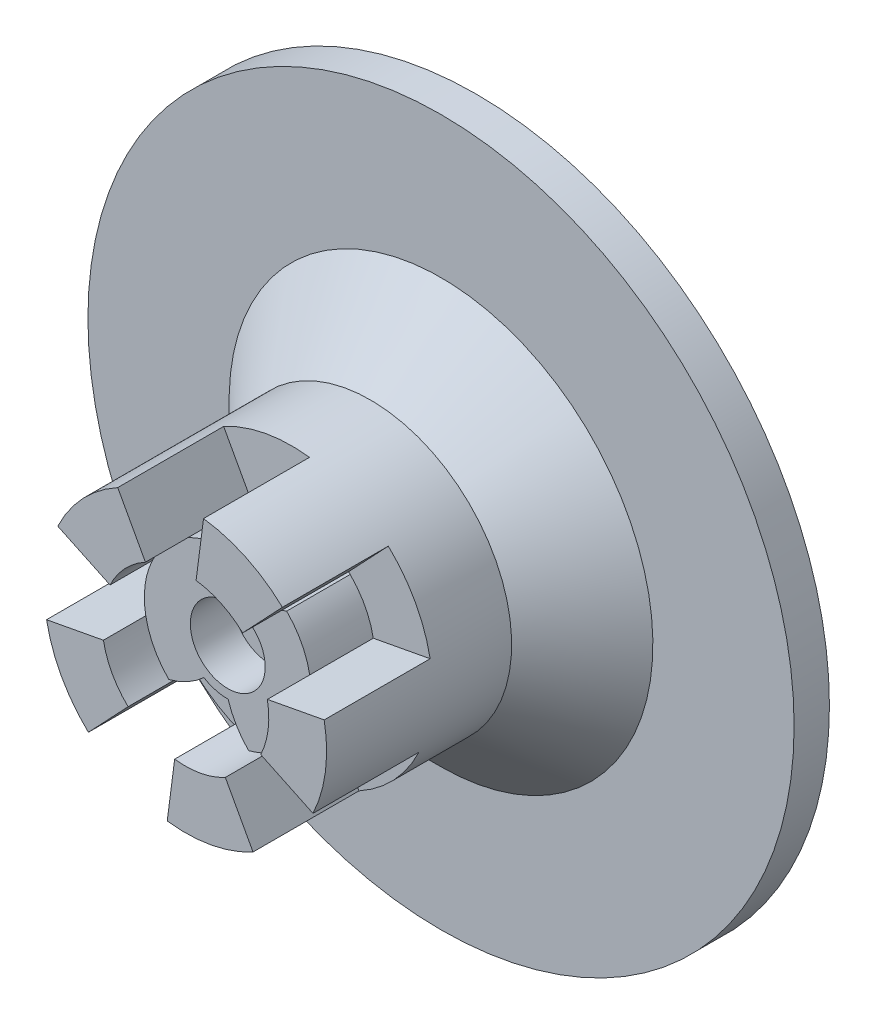
from build123d import *

# Parameters (mm, degrees)
SKETCH11_R          = 3.3672
CUT_EXTRUDE5_DEPTH  = 3.81
SKETCH11_5_R        = 3.3672
CUT_EXTRUDE7_DEPTH  = 7.62
CUT_EXTRUDE8_DEPTH  = 10.16
SKETCH13_R          = 6.35
CUT_EXTRUDE10_DEPTH = 12.192
CHAMFER1_SIZE       = 5.842
CHAMFER2_SIZE       = 6.35
CUT_EXTRUDE11_DEPTH = 9.525


with BuildPart() as part:
    # Sketch2 → Revolve1 (revolve)
    with BuildSketch(Plane(origin=(0, 0, 0), x_dir=(0, 0, -1), z_dir=(1, 0, 0))):
        Polygon((-13.081, 0), (-13.081, 9.525), (-13.081, 12.7), (-9.906, 12.7), (9.906, 12.7), (9.906, 31.75), (13.081, 31.75), (13.081, 0), align=None)
    revolve(axis=Axis((0, 0, -13.081), (0, 0, 1)))

    # Sketch11 → Cut-Extrude5 (cut)
    # profile 1 of 4: a face of its own
    with BuildSketch(Plane.XY.offset(13.081)):
        with BuildLine():
            ThreePointArc((-5.295442149, -5.31114794), (-1.969377828, -7.23681912), (1.873833325, -7.262144908))
            ThreePointArc((1.873833325, -7.262144908), (0.767613275, -5.832118974), (0.033615166, -4.179864833))
            ThreePointArc((0.033615166, -4.179864833), (-1.097599909, -4.033320523), (-2.147079662, -3.586425647))
            ThreePointArc((-2.147079662, -3.586425647), (-3.617120551, -4.638887883), (-5.295442149, -5.31114794))
        make_face()
    # profile 2 of 4: a face of its own
    with BuildSketch(Plane.XY.offset(13.081)):
        with BuildLine():
            ThreePointArc((7.5, 0), (6.926969616, 2.875255109), (5.295442149, 5.31114794))
            ThreePointArc((5.295442149, 5.31114794), (3.617120551, 4.638887883), (2.147079662, 3.586425647))
            ThreePointArc((2.147079662, 3.586425647), (1.097599909, 4.033320523), (-0.033615166, 4.179864833))
            ThreePointArc((-0.033615166, 4.179864833), (-0.767613275, 5.832118974), (-1.873833325, 7.262144908))
            ThreePointArc((-1.873833325, 7.262144908), (-7.23681912, 1.969377828), (-5.295442149, -5.31114794))
            ThreePointArc((-5.295442149, -5.31114794), (-3.617120551, -4.638887883), (-2.147079662, -3.586425647))
            ThreePointArc((-2.147079662, -3.586425647), (-1.097599909, -4.033320523), (0.033615166, -4.179864833))
            ThreePointArc((0.033615166, -4.179864833), (0.767613275, -5.832118974), (1.873833325, -7.262144908))
            ThreePointArc((1.873833325, -7.262144908), (5.928901666, -4.593269536), (7.5, 0))
        make_face()
        Circle(SKETCH11_R, mode=Mode.SUBTRACT)
    # profile 3 of 4: a face of its own
    with BuildSketch(Plane.XY.offset(13.081)):
        Circle(SKETCH11_R)
    # profile 4 of 4: a face of its own
    with BuildSketch(Plane.XY.offset(13.081)):
        with BuildLine():
            ThreePointArc((2.147079662, 3.586425647), (3.617120551, 4.638887883), (5.295442149, 5.31114794))
            ThreePointArc((5.295442149, 5.31114794), (1.969377828, 7.23681912), (-1.873833325, 7.262144908))
            ThreePointArc((-1.873833325, 7.262144908), (-0.767613275, 5.832118974), (-0.033615166, 4.179864833))
            ThreePointArc((-0.033615166, 4.179864833), (1.097599909, 4.033320523), (2.147079662, 3.586425647))
        make_face()
    extrude(amount=-CUT_EXTRUDE5_DEPTH, mode=Mode.SUBTRACT)

    # Sketch11<5> → Cut-Extrude7 (cut)
    with BuildSketch(Plane.XY.offset(13.081)):
        Circle(SKETCH11_5_R)
    extrude(amount=-CUT_EXTRUDE7_DEPTH, mode=Mode.SUBTRACT)

    # Sketch11<6> → Cut-Extrude8 (cut)
    with BuildSketch(Plane.XY.offset(13.081)):
        with BuildLine():
            ThreePointArc((-5.295442149, -5.31114794), (-1.969377828, -7.23681912), (1.873833325, -7.262144908))
            ThreePointArc((1.873833325, -7.262144908), (0.767613275, -5.832118974), (0.033615166, -4.179864833))
            ThreePointArc((0.033615166, -4.179864833), (-1.097599909, -4.033320523), (-2.147079662, -3.586425647))
            ThreePointArc((-2.147079662, -3.586425647), (-3.617120551, -4.638887883), (-5.295442149, -5.31114794))
        make_face()
        with BuildLine():
            ThreePointArc((2.147079662, 3.586425647), (3.617120551, 4.638887883), (5.295442149, 5.31114794))
            ThreePointArc((5.295442149, 5.31114794), (1.969377828, 7.23681912), (-1.873833325, 7.262144908))
            ThreePointArc((-1.873833325, 7.262144908), (-0.767613275, 5.832118974), (-0.033615166, 4.179864833))
            ThreePointArc((-0.033615166, 4.179864833), (1.097599909, 4.033320523), (2.147079662, 3.586425647))
        make_face()
    extrude(amount=-CUT_EXTRUDE8_DEPTH, mode=Mode.SUBTRACT)

    # Sketch13 → Cut-Extrude10 (cut)
    with BuildSketch(Plane(origin=(0, 0, -13.081), x_dir=(-1, 0, 0), z_dir=(0, 0, -1))):
        Circle(SKETCH13_R)
    extrude(amount=-CUT_EXTRUDE10_DEPTH, mode=Mode.SUBTRACT)

    # Chamfer1
    chamfer1_edges = [part.edges().sort_by_distance(p)[0] for p in [
        (6.35, 0, -0.889),
    ]]
    chamfer(chamfer1_edges, length=CHAMFER1_SIZE)

    # Chamfer2
    chamfer2_edges = [part.edges().sort_by_distance(p)[0] for p in [
        (0, -12.7, -9.906),
    ]]
    chamfer(chamfer2_edges, length=CHAMFER2_SIZE)

    # Sketch14 → Cut-Extrude11 (cut)
    with BuildSketch(Plane.XY.offset(13.081)):
        with BuildLine():
            Line((-6.77593781, 3.215068708), (-11.473921358, 5.444183013))
            ThreePointArc((-11.473921358, 5.444183013), (-12.594692746, 1.632089038), (-12.482607856, -2.339765182))
            Line((-12.482607856, -2.339765182), (-7.371618813, -1.381751092))
            ThreePointArc((-7.371618813, -1.381751092), (-7.437810677, 0.963832109), (-6.77593781, 3.215068708))
        make_face()
        with BuildLine():
            ThreePointArc((1.632089038, 12.594692746), (-2.339765182, 12.482607856), (-6.082586885, 11.148638338))
            Line((-6.082586885, 11.148638338), (-3.592078869, 6.583841538))
            ThreePointArc((-3.592078869, 6.583841538), (-1.381751092, 7.371618813), (0.963832109, 7.437810677))
            Line((0.963832109, 7.437810677), (1.632089038, 12.594692746))
        make_face()
        with BuildLine():
            ThreePointArc((12.482607856, 2.339765182), (11.148638338, 6.082586885), (8.723362422, 9.230002603))
            Line((8.723362422, 9.230002603), (5.151591981, 5.450788939))
            ThreePointArc((5.151591981, 5.450788939), (6.583841538, 3.592078869), (7.371618813, 1.381751092))
            Line((7.371618813, 1.381751092), (12.482607856, 2.339765182))
        make_face()
        with BuildLine():
            Line((3.592078869, -6.583841538), (6.082586885, -11.148638338))
            ThreePointArc((6.082586885, -11.148638338), (9.230002603, -8.723362422), (11.473921358, -5.444183013))
            Line((11.473921358, -5.444183013), (6.77593781, -3.215068708))
            ThreePointArc((6.77593781, -3.215068708), (5.450788939, -5.151591981), (3.592078869, -6.583841538))
        make_face()
        with BuildLine():
            Line((-5.151591981, -5.450788939), (-8.723362422, -9.230002603))
            ThreePointArc((-8.723362422, -9.230002603), (-5.444183013, -11.473921358), (-1.632089038, -12.594692746))
            Line((-1.632089038, -12.594692746), (-0.963832109, -7.437810677))
            ThreePointArc((-0.963832109, -7.437810677), (-3.215068708, -6.77593781), (-5.151591981, -5.450788939))
        make_face()
    extrude(amount=-CUT_EXTRUDE11_DEPTH, mode=Mode.SUBTRACT)


solid = part.part
